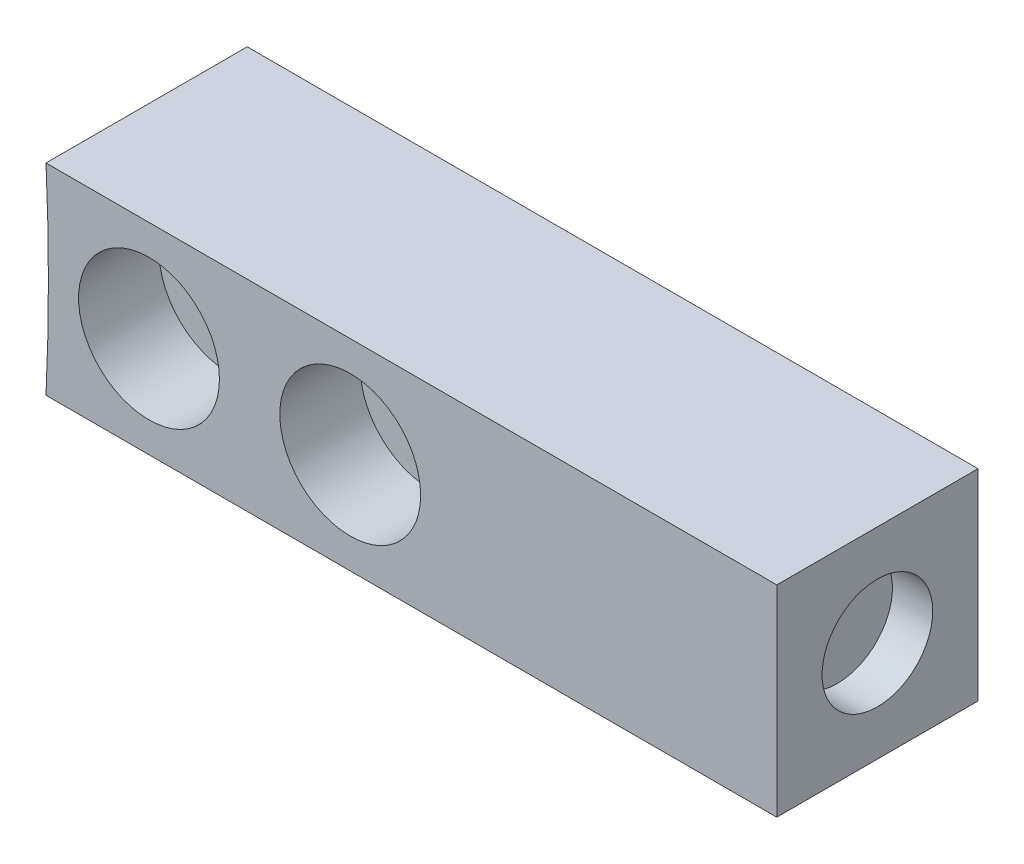
from build123d import *

# Parameters (mm, degrees)
ESQUISSE1_R             = 1.75
BOSS_EXTRU_1_DEPTH      = 10
ESQUISSE2_R             = 2.75
ENL_V_MAT_EXTRU_1_DEPTH = 2
ESQUISSE3_R             = 3.5
ENL_V_MAT_EXTRU_2_DEPTH = 4


with BuildPart() as part:
    # Esquisse1 → Boss.-Extru.1 (new body)
    with BuildSketch(Plane.XY):
        with BuildLine():
            Line((104.880884817, 5), (141.2, 5))
            Line((141.2, 5), (141.2, -5))
            Line((141.2, -5), (104.880884817, -5))
            ThreePointArc((104.880884817, -5), (105, 0), (104.880884817, 5))
        make_face()
        with Locations((110, 0)):
            Circle(ESQUISSE1_R, mode=Mode.SUBTRACT)
        with Locations((120, 0)):
            Circle(ESQUISSE1_R, mode=Mode.SUBTRACT)
    extrude(amount=BOSS_EXTRU_1_DEPTH)

    # Esquisse2 → Enlèv. mat.-Extru.1 (cut)
    with BuildSketch(Plane(origin=(141.2, 0, 0), x_dir=(0, 0, -1), z_dir=(1, 0, 0))):
        with Locations((-5, 0)):
            Circle(ESQUISSE2_R)
    extrude(amount=-ENL_V_MAT_EXTRU_1_DEPTH, mode=Mode.SUBTRACT)

    # Esquisse3 → Enlèv. mat.-Extru.2 (cut)
    with BuildSketch(Plane.XY.offset(10)):
        with Locations((110, 0)):
            Circle(ESQUISSE3_R)
        with Locations((120, 0)):
            Circle(ESQUISSE3_R)
    extrude(amount=-ENL_V_MAT_EXTRU_2_DEPTH, mode=Mode.SUBTRACT)


solid = part.part
